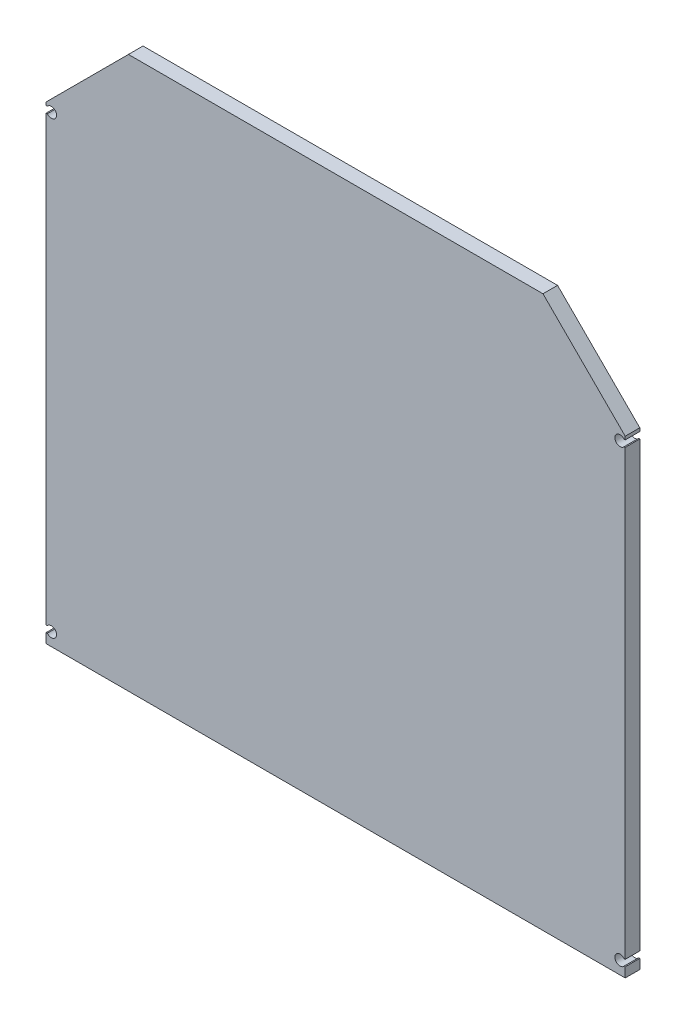
from build123d import *

# Parameters (mm, degrees)
BOSS_EXTRUDE1_DEPTH = 5.6388


with BuildPart() as part:
    # Sketch5 → Boss-Extrude1 (new body)
    with BuildSketch(Plane.XY):
        with BuildLine():
            Line((-111.565879557, 73.61243575), (-112.004630057, 73.61243575))
            Line((-112.004630057, 73.61243575), (-112.004630057, 74.86243575))
            Line((-112.004630057, 74.86243575), (-80.192037686, 106.675))
            Line((-80.192037686, 106.675), (80.192037686, 106.675))
            Line((80.192037686, 106.675), (112.004630057, 74.86243575))
            Line((112.004630057, 74.86243575), (112.004630057, 73.61243575))
            Line((112.004630057, 73.61243575), (111.565879557, 73.61243575))
            ThreePointArc((111.565879557, 73.61243575), (108.004630057, 72.36243575), (111.565879557, 71.11243575))
            Line((111.565879557, 71.11243575), (112.004630057, 71.11243575))
            Line((112.004630057, 71.11243575), (112.004630057, -100.425))
            Line((112.004630057, -100.425), (111.565879557, -100.425))
            ThreePointArc((111.565879557, -100.425), (108.004630057, -101.675), (111.565879557, -102.925))
            Line((111.565879557, -102.925), (112.004630057, -102.925))
            Line((112.004630057, -102.925), (112.004630057, -106.675))
            Line((112.004630057, -106.675), (-112.004630057, -106.675))
            Line((-112.004630057, -106.675), (-112.004630057, -102.925))
            Line((-112.004630057, -102.925), (-111.565879557, -102.925))
            ThreePointArc((-111.565879557, -102.925), (-108.004630057, -101.675), (-111.565879557, -100.425))
            Line((-111.565879557, -100.425), (-112.004630057, -100.425))
            Line((-112.004630057, -100.425), (-112.004630057, 71.11243575))
            Line((-112.004630057, 71.11243575), (-111.565879557, 71.11243575))
            ThreePointArc((-111.565879557, 71.11243575), (-108.004630057, 72.36243575), (-111.565879557, 73.61243575))
        make_face()
    extrude(amount=BOSS_EXTRUDE1_DEPTH)


solid = part.part
